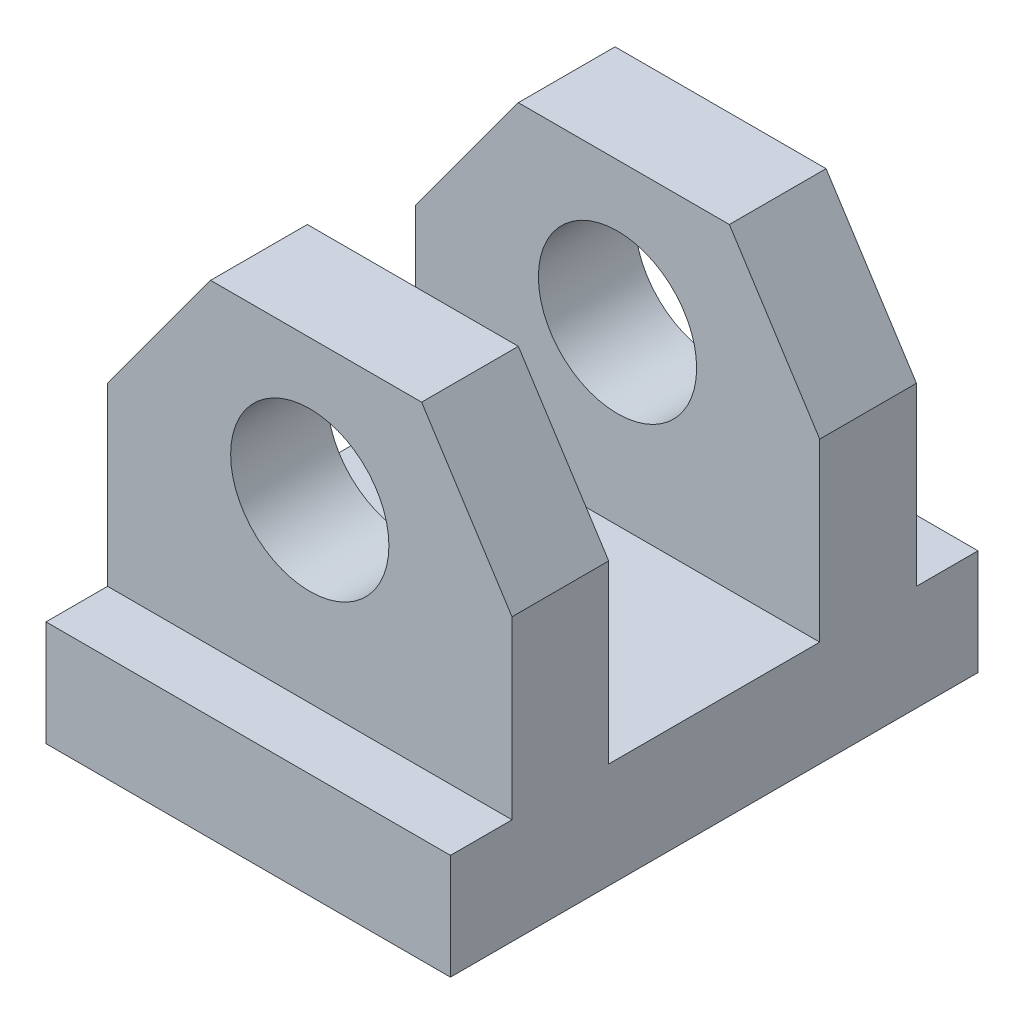
from build123d import *

# Parameters (mm, degrees)
CROQUIS1_R              = 9
SALIENTE_EXTRUIR1_DEPTH = 60
CROQUIS3_W              = 46
CROQUIS3_H              = 7
CORTAR_EXTRUIR1_DEPTH   = 36
CROQUIS4_W              = 47.607342582
CROQUIS4_H              = 24
CORTAR_EXTRUIR5_DEPTH   = 36


with BuildPart() as part:
    # Croquis1 → Saliente-Extruir1 (new body)
    with BuildSketch(Plane.XY):
        Polygon((-23, 0), (23, 0), (23, 32), (12.720887074, 48), (-11.279112926, 48), (-23, 32), align=None)
        with Locations((0, 32)):
            Circle(CROQUIS1_R, mode=Mode.SUBTRACT)
    extrude(amount=-SALIENTE_EXTRUIR1_DEPTH)

    # Croquis3 → Cortar-Extruir1 (cut)
    with BuildSketch(Plane(origin=(0, 48, 0), x_dir=(1, 0, 0), z_dir=(0, 1, 0))):
        with Locations((0, 3.5)):
            Rectangle(CROQUIS3_W, CROQUIS3_H)
        with Locations((0, 56.5)):
            Rectangle(CROQUIS3_W, CROQUIS3_H)
    extrude(amount=-CORTAR_EXTRUIR1_DEPTH, mode=Mode.SUBTRACT)

    # Croquis4 → Cortar-Extruir5 (cut)
    with BuildSketch(Plane(origin=(0, 48, 0), x_dir=(1, 0, 0), z_dir=(0, 1, 0))):
        with Locations((0.803671291, 30)):
            Rectangle(CROQUIS4_W, CROQUIS4_H)
    extrude(amount=-CORTAR_EXTRUIR5_DEPTH, mode=Mode.SUBTRACT)


solid = part.part
